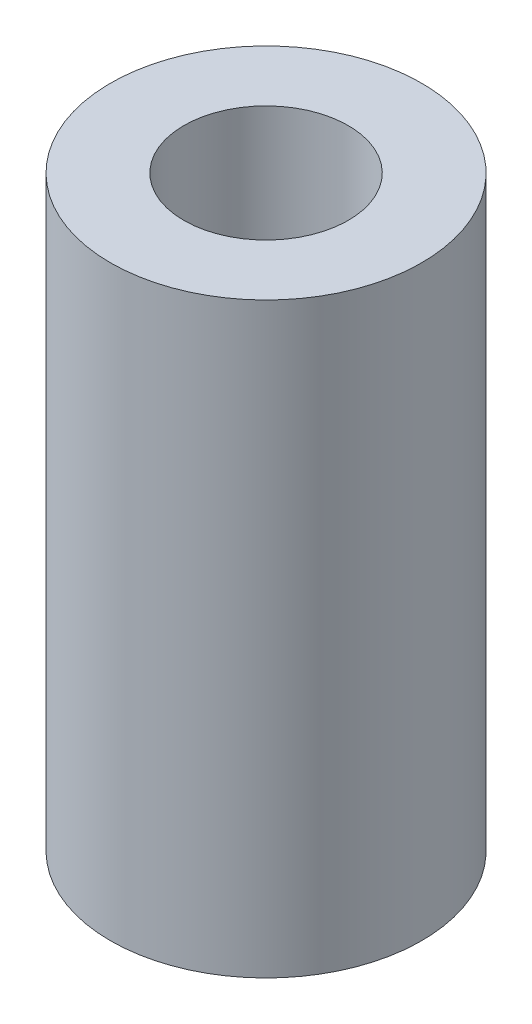
from build123d import *

# Parameters (mm, degrees)
SKETCH1_R           = 13.25
SKETCH1_R_2         = 7
BOSS_EXTRUDE1_DEPTH = 25


with BuildPart() as part:
    # Sketch1 → Boss-Extrude1 (new, symmetric)
    with BuildSketch(Plane(origin=(0, 0, 0), x_dir=(1, 0, 0), z_dir=(0, 1, 0))):
        with Locations(Location((0, 0, 0), (0, 0, 270))):
            Circle(SKETCH1_R)
        with Locations(Location((0, 0, 0), (0, 0, 270))):
            Circle(SKETCH1_R_2, mode=Mode.SUBTRACT)
    extrude(amount=BOSS_EXTRUDE1_DEPTH, both=True)


solid = part.part
